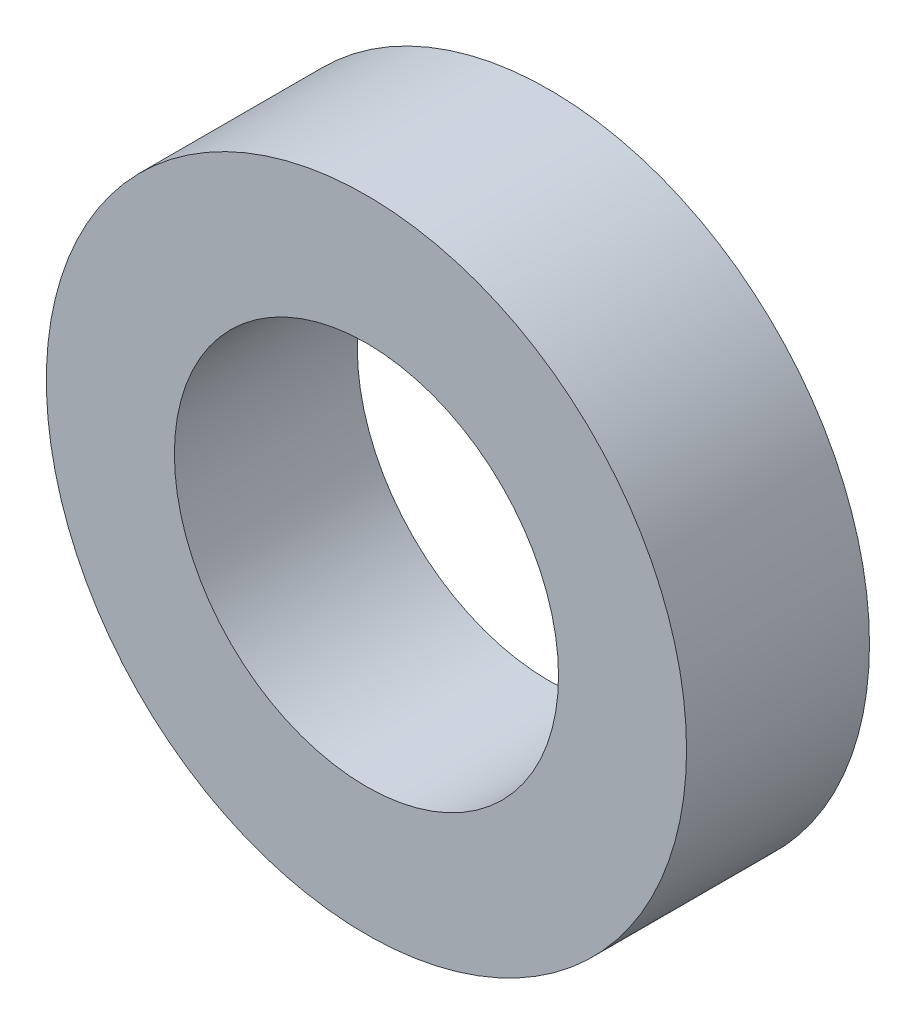
from build123d import *

# Parameters (mm, degrees)
ESQUISSE1_R        = 3.5
ESQUISSE1_R_2      = 2.1
BOSS_EXTRU_1_DEPTH = 2


with BuildPart() as part:
    # Esquisse1 → Boss.-Extru.1 (new body)
    with BuildSketch(Plane.XY):
        Circle(ESQUISSE1_R)
        Circle(ESQUISSE1_R_2, mode=Mode.SUBTRACT)
    extrude(amount=BOSS_EXTRU_1_DEPTH)


solid = part.part
